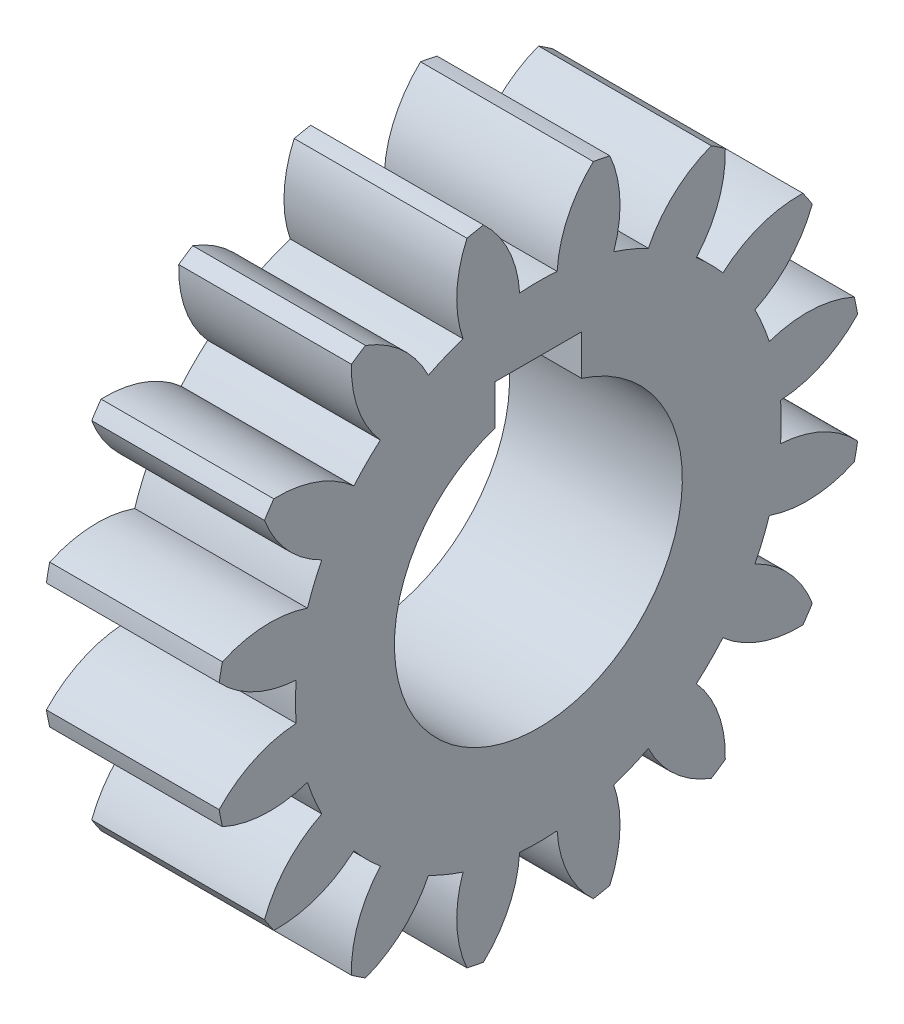
from build123d import *

# Parameters (mm, degrees)
BASPROSKE_W              = 6
BASPROSKE_H              = 11.25
TOOTHCUT_DEPTH           = 18.003676073
TEETHCUTS_COUNT          = 16
TEETHCUTS_ANGLE          = 337.5
BORSKE_R                 = 0.4
BORE_DEPTH               = 50.0000508
TAGLIO_ESTRUSIONE1_DEPTH = 10


with BuildPart() as part:
    # BasProSke → Base-Revolve (revolve)
    with BuildSketch(Plane(origin=(0, 0, 0), x_dir=(1, 0, 0), z_dir=(0, 1, 0)), mode=Mode.PRIVATE) as base_revolve_sk:
        with Locations((3, 5.625)):
            Rectangle(BASPROSKE_W, BASPROSKE_H)
    revolve(base_revolve_sk.sketch.rotate(Axis((-10, 0, 0), (1, 0, 0)), 180), axis=Axis((-10, 0, 0), (1, 0, 0)))

    # TooCutSke → ToothCut (cut, through all)
    with BuildSketch(Plane(origin=(0, 0, 0), x_dir=(0, 0, -1), z_dir=(1, 0, 0))):
        with BuildLine():
            ThreePointArc((0.651061533, 8.411340626), (0, 8.4365), (-0.651061533, 8.411340626))
            ThreePointArc((-0.651061533, 8.411340626), (-1.029874156, 9.883978829), (-1.930926138, 11.108832945))
            ThreePointArc((-1.930926138, 11.108832945), (0, 11.2754), (1.930926138, 11.108832945))
            ThreePointArc((1.930926138, 11.108832945), (1.029874156, 9.883978829), (0.651061533, 8.411340626))
        make_face()
    toothcut = extrude(amount=TOOTHCUT_DEPTH, mode=Mode.SUBTRACT)

    # TeethCuts: ToothCut ×16 about axis
    teethcuts_axis = Axis((-10, 0, 0), (1, 0, 0))
    for i in range(1, TEETHCUTS_COUNT):
        add(toothcut.rotate(teethcuts_axis, i * TEETHCUTS_ANGLE / (TEETHCUTS_COUNT - 1)), mode=Mode.SUBTRACT)

    # BorSke → Bore (cut, symmetric)
    with BuildSketch(Plane(origin=(0, 0, 0), x_dir=(0, 0, -1), z_dir=(1, 0, 0))):
        with Locations(Location((0, 0, 0), (0, 0, 180))):
            Circle(BORSKE_R)
    extrude(amount=BORE_DEPTH, both=True, mode=Mode.SUBTRACT)

    # Schizzo1 → Taglio-Estrusione1 (cut)
    # profile 1 of 3: a face of its own
    with BuildSketch(Plane(origin=(6, 0, 0), x_dir=(0, 0, -1), z_dir=(1, 0, 0))):
        with BuildLine():
            ThreePointArc((1.5, 4.769696007), (0.758788496, 4.942088629), (0, 5))
            ThreePointArc((0, 5), (-0.758788496, 4.942088629), (-1.5, 4.769696007))
            ThreePointArc((-1.5, 4.769696007), (-2.958039892, -4.031128874), (5, 0))
            ThreePointArc((5, 0), (4.031128874, 2.958039892), (1.5, 4.769696007))
        make_face()
        with BuildLine():
            ThreePointArc((0.4, 0), (-0.282842712, -0.282842712), (0, 0.4))
            ThreePointArc((0, 0.4), (0.282842712, 0.282842712), (0.4, 0))
        make_face(mode=Mode.SUBTRACT)
    # profile 2 of 3: a face of its own
    with BuildSketch(Plane(origin=(6, 0, 0), x_dir=(0, 0, -1), z_dir=(1, 0, 0))):
        with BuildLine():
            ThreePointArc((-1.5, 4.769696007), (-0.758788496, 4.942088629), (0, 5))
            Line((0, 5), (0, 6.169696007))
            Line((0, 6.169696007), (-1.5, 6.169696007))
            Line((-1.5, 6.169696007), (-1.5, 4.769696007))
        make_face()
    # profile 3 of 3: a face of its own
    with BuildSketch(Plane(origin=(6, 0, 0), x_dir=(0, 0, -1), z_dir=(1, 0, 0))):
        with BuildLine():
            Line((0, 6.169696007), (0, 5))
            ThreePointArc((0, 5), (0.758788496, 4.942088629), (1.5, 4.769696007))
            Line((1.5, 4.769696007), (1.5, 6.169696007))
            Line((1.5, 6.169696007), (0, 6.169696007))
        make_face()
    extrude(amount=-TAGLIO_ESTRUSIONE1_DEPTH, mode=Mode.SUBTRACT)


solid = part.part
